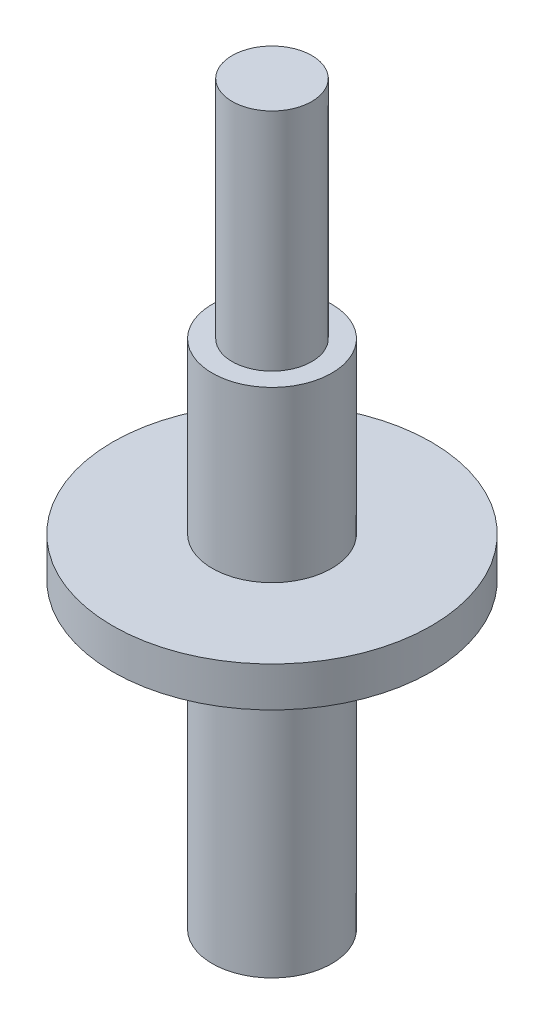
from build123d import *

# Parameters (mm, degrees)
SKETCH2_R          = 2
CUT_EXTRUDE1_DEPTH = 6


with BuildPart() as part:
    # Sketch1 → Revolve1 (revolve)
    with BuildSketch(Plane.XY, mode=Mode.PRIVATE) as revolve1_sk:
        Polygon((0, 0), (0, 37), (2, 37), (2, 25.684518386), (3, 25.684518386), (3, 17.191909634), (8, 17.191909634), (8, 15.191909634), (3, 15.191909634), (3, 0), align=None)
    revolve(revolve1_sk.sketch.rotate(Axis((0, 0, 0), (0, 1, 0)), 90), axis=Axis((0, 0, 0), (0, 1, 0)))

    # Sketch2 → Cut-Extrude1 (cut)
    with BuildSketch(Plane.XZ):
        with Locations(Location((0, 0, 0), (0, 0, 270))):
            Circle(SKETCH2_R)
    extrude(amount=-CUT_EXTRUDE1_DEPTH, mode=Mode.SUBTRACT)


solid = part.part
